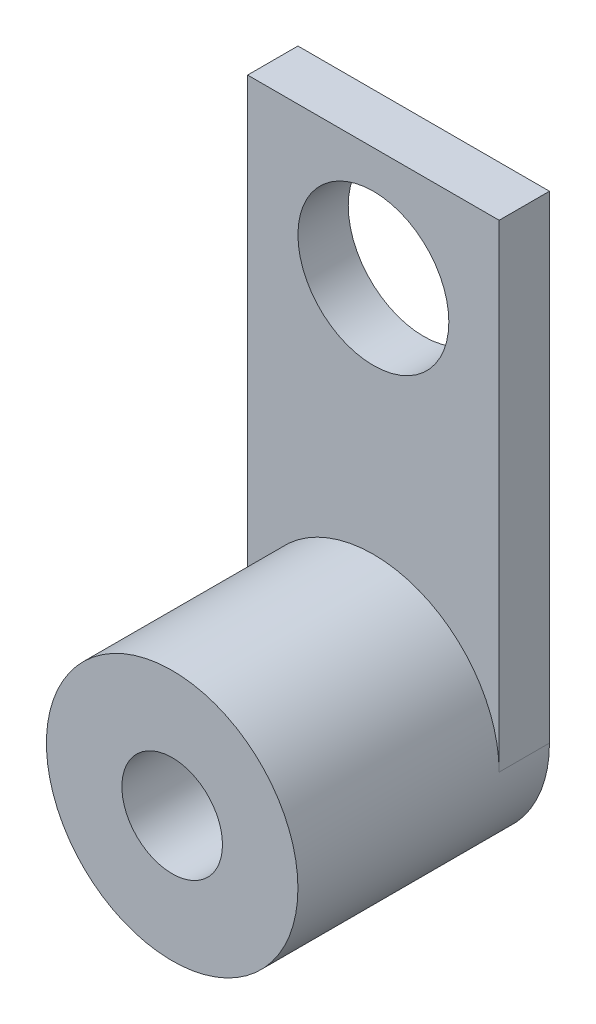
from build123d import *

# Parameters (mm, degrees)
SKETCH3_R           = 63.5
SKETCH3_R_2         = 25.4
BOSS_EXTRUDE1_DEPTH = 127
SKETCH4_R           = 25.4
SKETCH4_R_2         = 38.1
BOSS_EXTRUDE2_DEPTH = 25.4


with BuildPart() as part:
    # Sketch3 → Boss-Extrude1 (new body)
    with BuildSketch(Plane(origin=(0, 0, 0), x_dir=(0, 1, 0), z_dir=(0, 0, 1))):
        with Locations(Location((0, 0, 0), (0, 0, 270))):
            Circle(SKETCH3_R)
        with Locations(Location((0, 0, 0), (0, 0, 270))):
            Circle(SKETCH3_R_2, mode=Mode.SUBTRACT)
    extrude(amount=BOSS_EXTRUDE1_DEPTH)

    # Sketch4 → Boss-Extrude2 (add)
    with BuildSketch(Plane(origin=(0, 0, 0), x_dir=(0, 1, 0), z_dir=(0, 0, 1))):
        with BuildLine():
            Line((0, 63.5), (241.3, 63.5))
            Line((241.3, 63.5), (241.3, -63.5))
            Line((241.3, -63.5), (0, -63.5))
            ThreePointArc((0, -63.5), (-63.5, 0), (0, 63.5))
        make_face()
        with Locations(Location((0, 0, 0), (0, 0, 270))):
            Circle(SKETCH4_R, mode=Mode.SUBTRACT)
        with Locations(Location((184.15, 0, 0), (0, 0, 270))):
            Circle(SKETCH4_R_2, mode=Mode.SUBTRACT)
    extrude(amount=BOSS_EXTRUDE2_DEPTH)


solid = part.part
